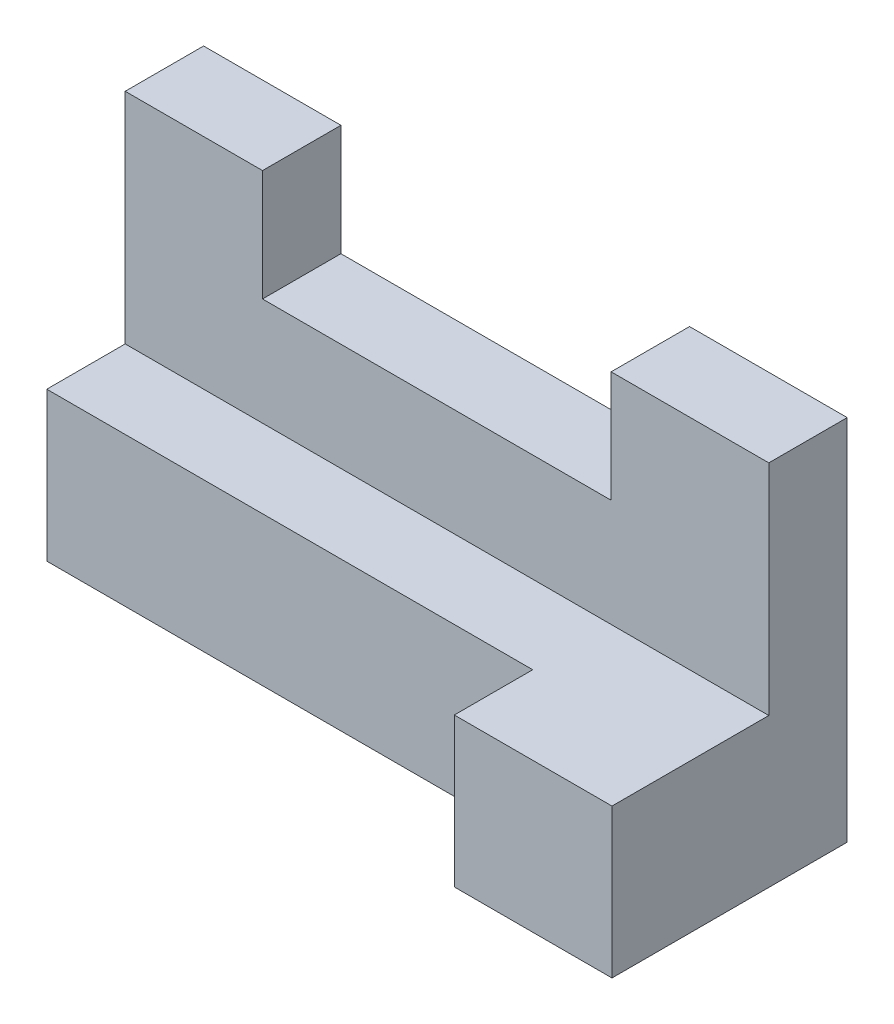
from build123d import *

# Parameters (mm, degrees)
EXTRUDE_1_DEPTH = 10
SKETCH_1_3_W    = 20.109572138
SKETCH_1_3_H    = 18.992234217
EXTRUDE_2_DEPTH = 30
SKETCH_1_4_W    = 61.971467386
SKETCH_1_4_H    = 18.992234217
EXTRUDE_3_DEPTH = 20


with BuildPart() as part:
    # 草圖1 → 填料-伸長1 (new body)
    with BuildSketch(Plane.XY):
        Polygon((-39.506294724, 27.903717876), (-39.506294724, 0), (22.465172662, 0), (42.5747448, 0), (42.5747448, 27.903717876), (22.465172662, 27.903717876), (22.465172662, 13.719879355), (-21.993563511, 13.719879355), (-21.993563511, 27.903717876), align=None)
    extrude(amount=EXTRUDE_1_DEPTH)

    # 草圖1<3> → 填料-伸長2 (add)
    with BuildSketch(Plane.XY):
        with Locations((32.519958731, -9.496117109)):
            Rectangle(SKETCH_1_3_W, SKETCH_1_3_H)
    extrude(amount=EXTRUDE_2_DEPTH)

    # 草圖1<4> → 填料-伸長3 (add)
    with BuildSketch(Plane.XY):
        with Locations((-8.520561031, -9.496117109)):
            Rectangle(SKETCH_1_4_W, SKETCH_1_4_H)
    extrude(amount=EXTRUDE_3_DEPTH)


solid = part.part
